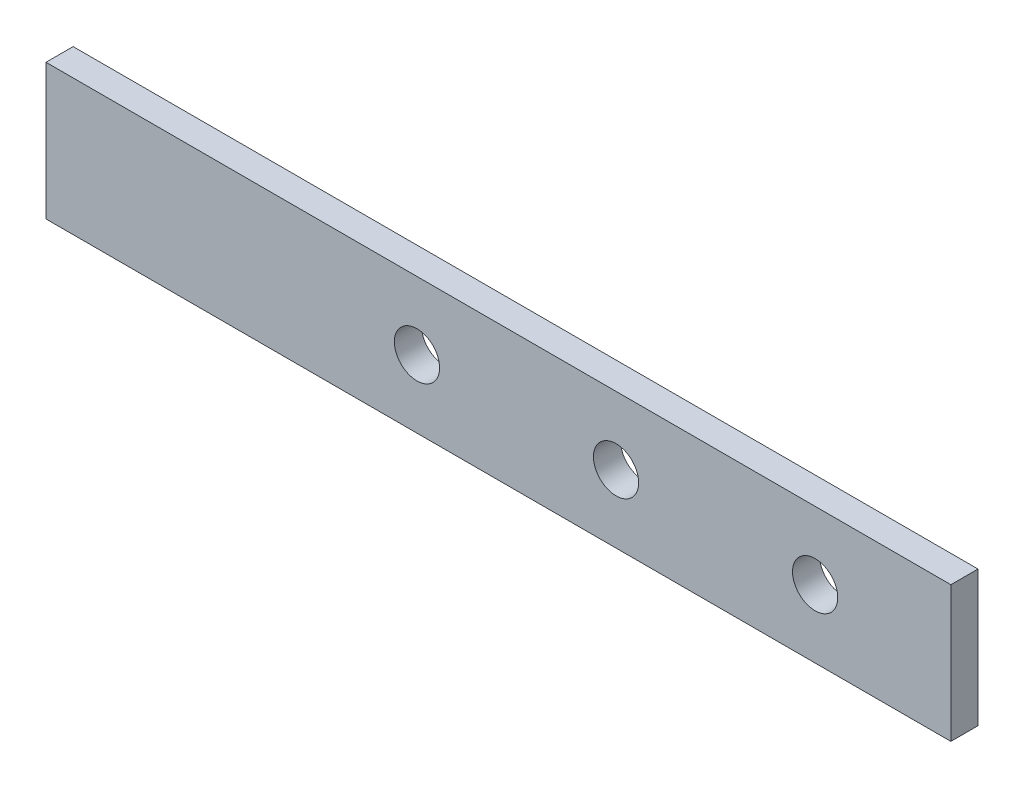
from build123d import *

# Parameters (mm, degrees)
SKETCH2_W           = 1000
SKETCH2_H           = 150
SKETCH2_R           = 25
BOSS_EXTRUDE1_DEPTH = 30


with BuildPart() as part:
    # Sketch2 → Boss-Extrude1 (new body)
    with BuildSketch(Plane.XY):
        Rectangle(SKETCH2_W, SKETCH2_H)
        with Locations((130, 0)):
            Circle(SKETCH2_R, mode=Mode.SUBTRACT)
        with Locations((-90, 0)):
            Circle(SKETCH2_R, mode=Mode.SUBTRACT)
        with Locations((350, 0)):
            Circle(SKETCH2_R, mode=Mode.SUBTRACT)
    extrude(amount=-BOSS_EXTRUDE1_DEPTH)


solid = part.part
